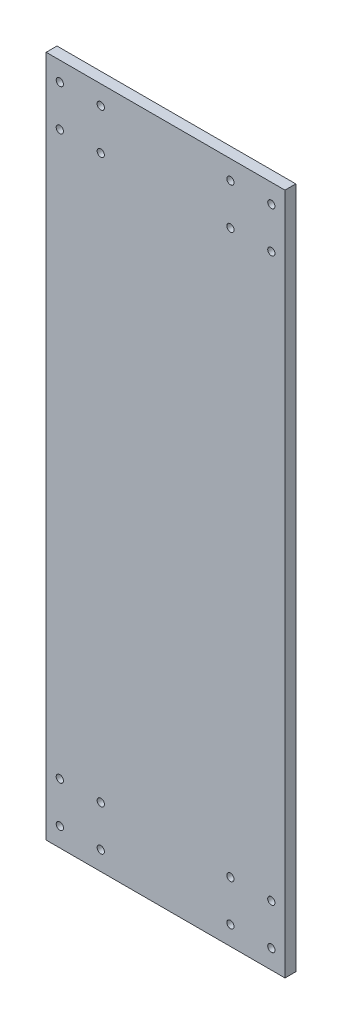
from build123d import *

# Parameters (mm, degrees)
SKETCH1_W           = 140
SKETCH1_H           = 400
SKETCH1_R           = 2.125
BOSS_EXTRUDE1_DEPTH = 6.35


with BuildPart() as part:
    # Sketch1 → Boss-Extrude1 (new body)
    with BuildSketch(Plane.XY):
        Rectangle(SKETCH1_W, SKETCH1_H)
        with Locations((-62, 188.825)):
            Circle(SKETCH1_R, mode=Mode.SUBTRACT)
        with Locations(Location((-38, 188.825, 0), (0, 0, 180))):
            Circle(SKETCH1_R, mode=Mode.SUBTRACT)
        with Locations((-38, 164.825)):
            Circle(SKETCH1_R, mode=Mode.SUBTRACT)
        with Locations(Location((-62, 164.825, 0), (0, 0, 180))):
            Circle(SKETCH1_R, mode=Mode.SUBTRACT)
        with Locations(Location((38, 164.825, 0), (0, 0, 180))):
            Circle(SKETCH1_R, mode=Mode.SUBTRACT)
        with Locations((62, 164.825)):
            Circle(SKETCH1_R, mode=Mode.SUBTRACT)
        with Locations((38, 188.825)):
            Circle(SKETCH1_R, mode=Mode.SUBTRACT)
        with Locations(Location((62, 188.825, 0), (0, 0, 180))):
            Circle(SKETCH1_R, mode=Mode.SUBTRACT)
        with Locations((62, -188.825)):
            Circle(SKETCH1_R, mode=Mode.SUBTRACT)
        with Locations(Location((38, -188.825, 0), (0, 0, 180))):
            Circle(SKETCH1_R, mode=Mode.SUBTRACT)
        with Locations(Location((62, -164.825, 0), (0, 0, 180))):
            Circle(SKETCH1_R, mode=Mode.SUBTRACT)
        with Locations((38, -164.825)):
            Circle(SKETCH1_R, mode=Mode.SUBTRACT)
        with Locations((-62, -164.825)):
            Circle(SKETCH1_R, mode=Mode.SUBTRACT)
        with Locations(Location((-38, -164.825, 0), (0, 0, 180))):
            Circle(SKETCH1_R, mode=Mode.SUBTRACT)
        with Locations((-38, -188.825)):
            Circle(SKETCH1_R, mode=Mode.SUBTRACT)
        with Locations(Location((-62, -188.825, 0), (0, 0, 180))):
            Circle(SKETCH1_R, mode=Mode.SUBTRACT)
    extrude(amount=BOSS_EXTRUDE1_DEPTH)


solid = part.part
